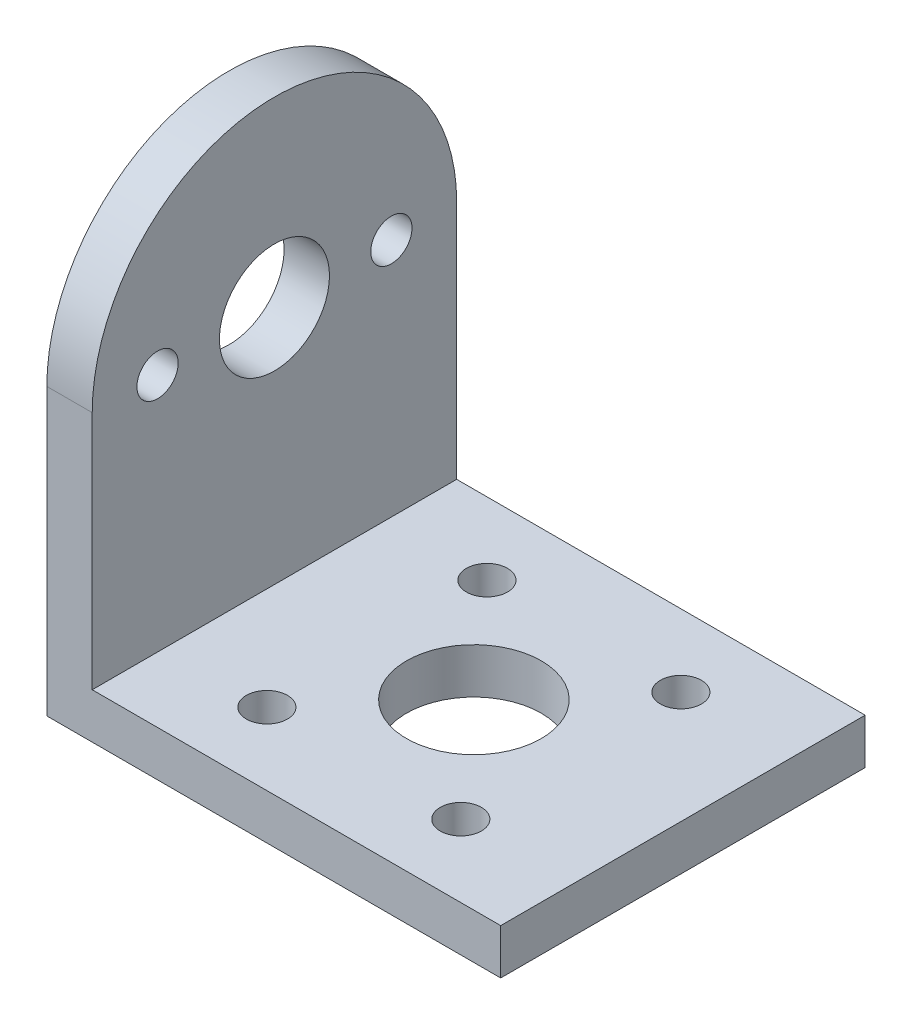
from build123d import *

# Parameters (mm, degrees)
SKETCH_1_R      = 4
SKETCH_1_R_2    = 1.5
EXTRUDE_1_DEPTH = 3.3
SKETCH_2_W      = 33
SKETCH_2_H      = 26.5
SKETCH_2_R      = 4.9
SKETCH_2_R_2    = 1.495427909
EXTRUDE_2_DEPTH = 3.3


with BuildPart() as part:
    # 草图1 → 凸台-拉伸1 (new body)
    with BuildSketch(Plane(origin=(0, 0, 0), x_dir=(0, 0, -1), z_dir=(1, 0, 0))):
        with BuildLine():
            Line((-13.25, 0), (-13.25, -20.75))
            Line((-13.25, -20.75), (13.25, -20.75))
            Line((13.25, -20.75), (13.25, 0))
            ThreePointArc((13.25, 0), (0, 13.25), (-13.25, 0))
        make_face()
        Circle(SKETCH_1_R, mode=Mode.SUBTRACT)
        with Locations((8.5, 0)):
            Circle(SKETCH_1_R_2, mode=Mode.SUBTRACT)
        with Locations(Location((-8.5, 0, 0), (0, 0, 180))):
            Circle(SKETCH_1_R_2, mode=Mode.SUBTRACT)
    extrude(amount=EXTRUDE_1_DEPTH)

    # 草图2 → 凸台-拉伸2 (add)
    with BuildSketch(Plane.XZ.offset(20.75)):
        with Locations((16.5, 0)):
            Rectangle(SKETCH_2_W, SKETCH_2_H)
        with Locations(Location((17.8, 0, 0), (0, 0, 270))):
            Circle(SKETCH_2_R, mode=Mode.SUBTRACT)
        with Locations(Location((24.85, -8, 0), (0, 0, 270))):
            Circle(SKETCH_2_R_2, mode=Mode.SUBTRACT)
        with Locations(Location((24.85, 8, 0), (0, 0, 90))):
            Circle(SKETCH_2_R_2, mode=Mode.SUBTRACT)
        with Locations(Location((10.75, 8, 0), (0, 0, 270))):
            Circle(SKETCH_2_R_2, mode=Mode.SUBTRACT)
        with Locations(Location((10.75, -8, 0), (0, 0, 90))):
            Circle(SKETCH_2_R_2, mode=Mode.SUBTRACT)
    extrude(amount=-EXTRUDE_2_DEPTH)


solid = part.part
